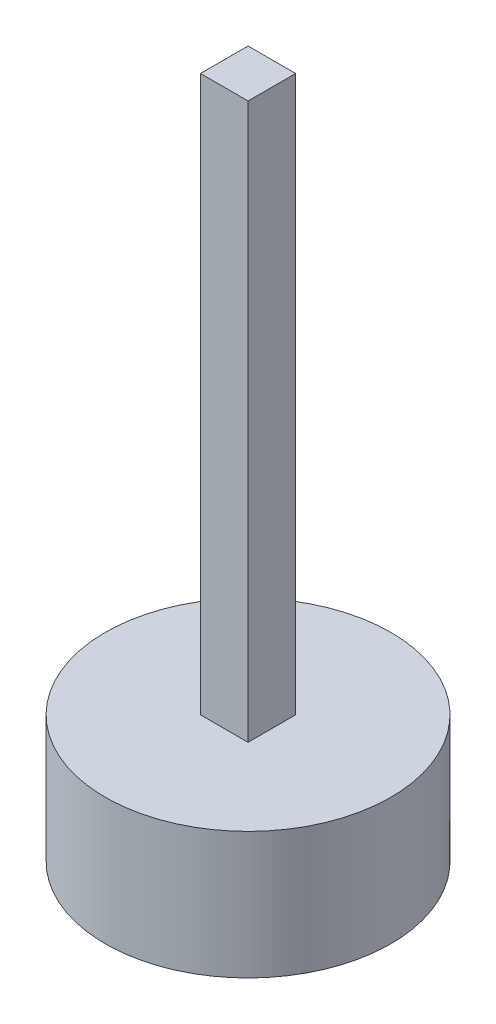
from build123d import *

# Parameters (mm, degrees)
SKETCH1_W           = 30
SKETCH1_H           = 30
BOSS_EXTRUDE1_DEPTH = 350
SKETCH2_R           = 90
BOSS_EXTRUDE2_DEPTH = 80


with BuildPart() as part:
    # Sketch1 → Boss-Extrude1 (new body)
    with BuildSketch(Plane(origin=(0, 0, 0), x_dir=(1, 0, 0), z_dir=(0, 1, 0))):
        with Locations((0, 15)):
            Rectangle(SKETCH1_W, SKETCH1_H)
    extrude(amount=-BOSS_EXTRUDE1_DEPTH)

    # Sketch2 → Boss-Extrude2 (add)
    with BuildSketch(Plane.XZ.offset(350)):
        with Locations(Location((0, -15, 0), (0, 0, 270))):
            Circle(SKETCH2_R)
    extrude(amount=BOSS_EXTRUDE2_DEPTH)


solid = part.part
